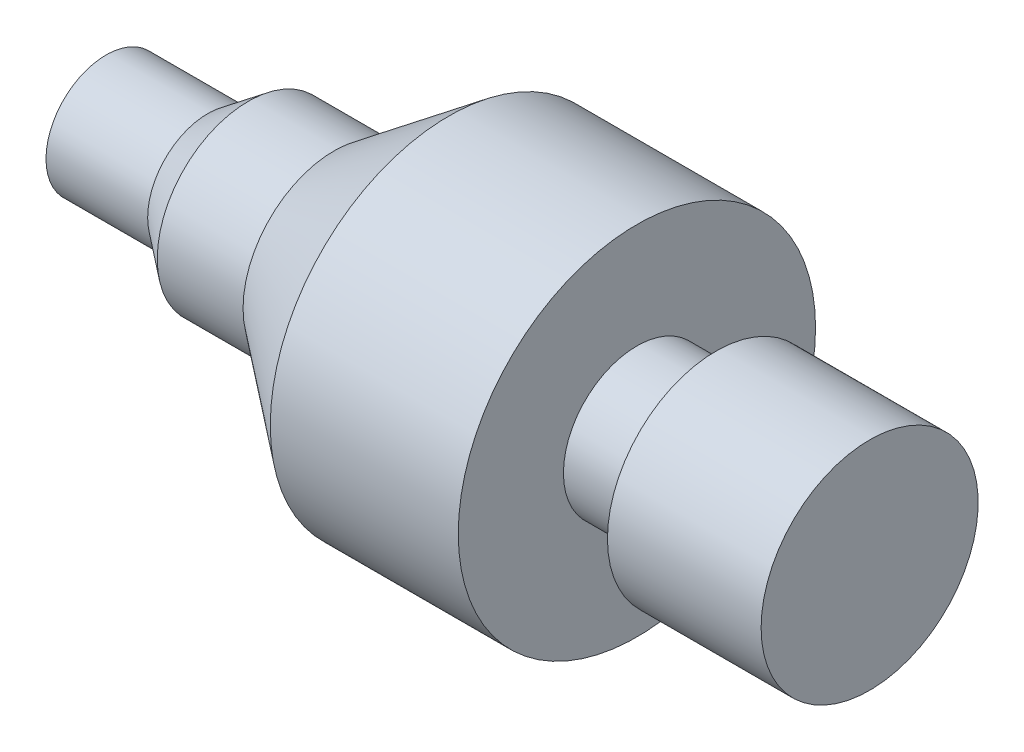
from build123d import *


with BuildPart() as part:
    # Sketch2 → Revolve1 (revolve)
    with BuildSketch(Plane.XY, mode=Mode.PRIVATE) as revolve1_sk:
        Polygon((68.497321264, 0), (68.497321264, 9.73656509), (54.712218799, 9.73656509), (54.712218799, 6.591420353), (47.618913648, 6.591420353), (47.618913648, 16.026854564), (30.755584419, 16.026854564), (20.450216557, 8.163992722), (12.754649648, 8.163992722), (9.119217922, 5.390205529), (0, 5.390205529), (0, 0), align=None)
    revolve(revolve1_sk.sketch.rotate(Axis((0, 0, 0), (1, 0, 0)), 90), axis=Axis((0, 0, 0), (1, 0, 0)))


solid = part.part
